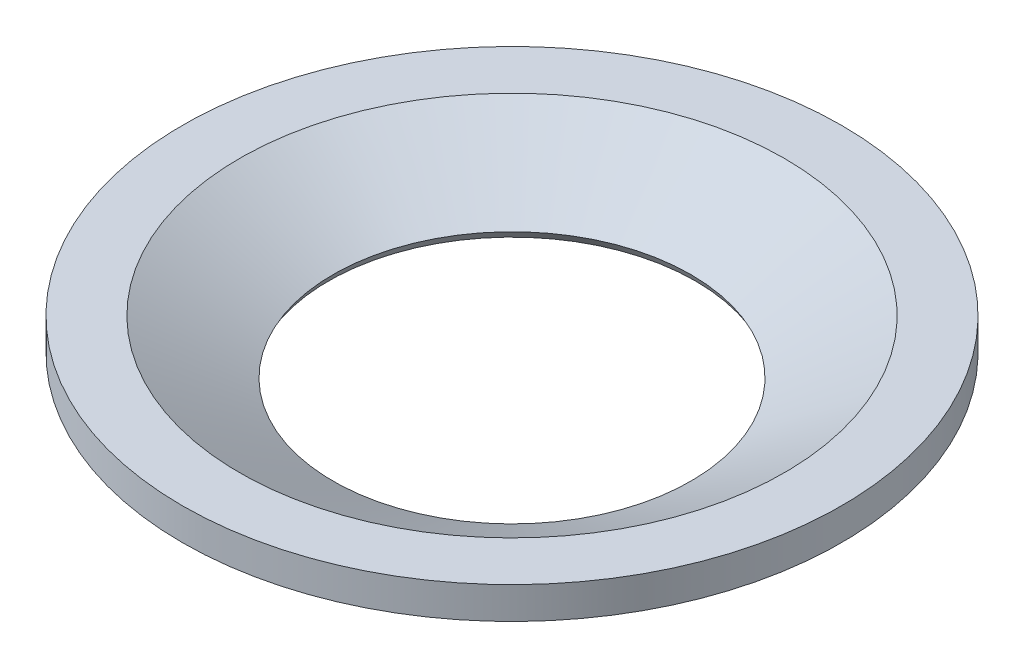
from build123d import *


with BuildPart() as part:
    # Sketch1 → Revolve-Thin1 (revolve)
    with BuildSketch(Plane.XY, mode=Mode.PRIVATE) as revolve_thin1_sk:
        Polygon((-25.527, -7.332348419), (-38.227, 0), (-44.577, 0), (-44.577, -3.175), (-45.847, -3.175), (-45.847, 1.27), (-37.886704526, 1.27), (-24.892, -6.232496156), align=None)
    revolve(revolve_thin1_sk.sketch.rotate(Axis((0, 0, 0), (0, 1, 0)), 270), axis=Axis((0, 0, 0), (0, 1, 0)))


solid = part.part
